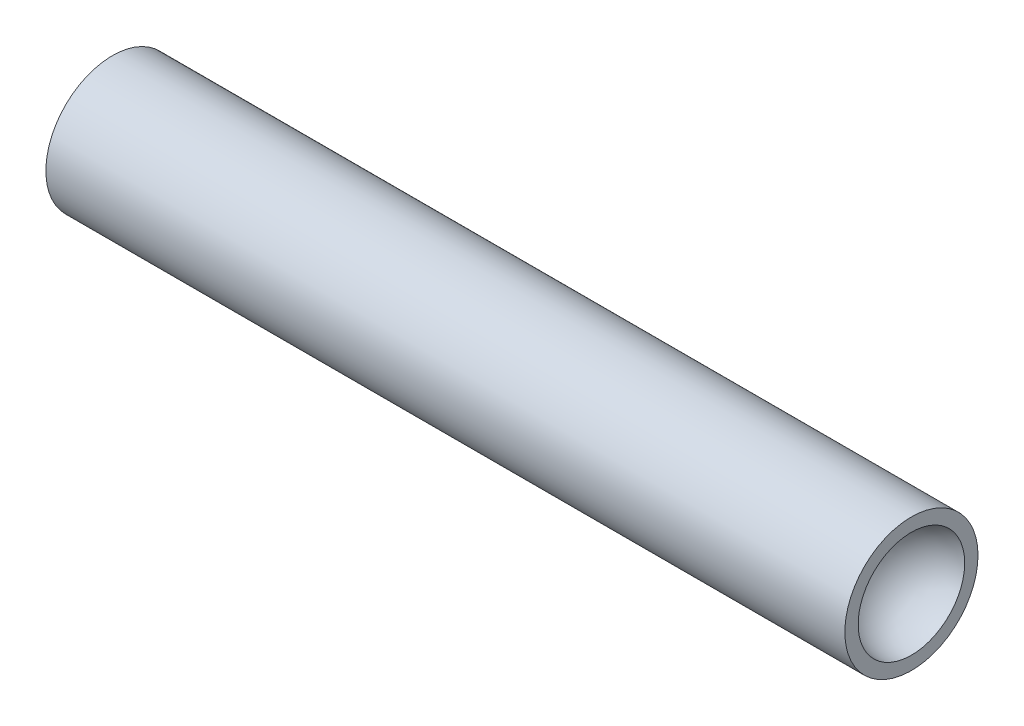
from build123d import *

# Parameters (mm, degrees)
SKETCH1_R           = 25
BOSS_EXTRUDE1_DEPTH = 300
SKETCH3_R           = 20
CUT_EXTRUDE1_DEPTH  = 200


with BuildPart() as part:
    # Sketch1 → Boss-Extrude1 (new body)
    with BuildSketch(Plane(origin=(0, 0, 0), x_dir=(0, 0, -1), z_dir=(1, 0, 0))):
        Circle(SKETCH1_R)
    extrude(amount=BOSS_EXTRUDE1_DEPTH)

    # Sketch2 → Cut-Revolve3 (revolve, cut)
    with BuildSketch(Plane(origin=(300, 0, 0), x_dir=(0, 0, -1), z_dir=(1, 0, 0))):
        with BuildLine():
            Line((-20, 0), (20, 0))
            ThreePointArc((20, 0), (0, 20), (-20, 0))
        make_face()
    revolve(axis=Axis((300, 0, 20), (0, 0, -1)), mode=Mode.SUBTRACT)

    # Sketch3 → Cut-Extrude1 (cut)
    with BuildSketch(Plane.ZY):
        Circle(SKETCH3_R)
    extrude(amount=-CUT_EXTRUDE1_DEPTH, mode=Mode.SUBTRACT)


solid = part.part
